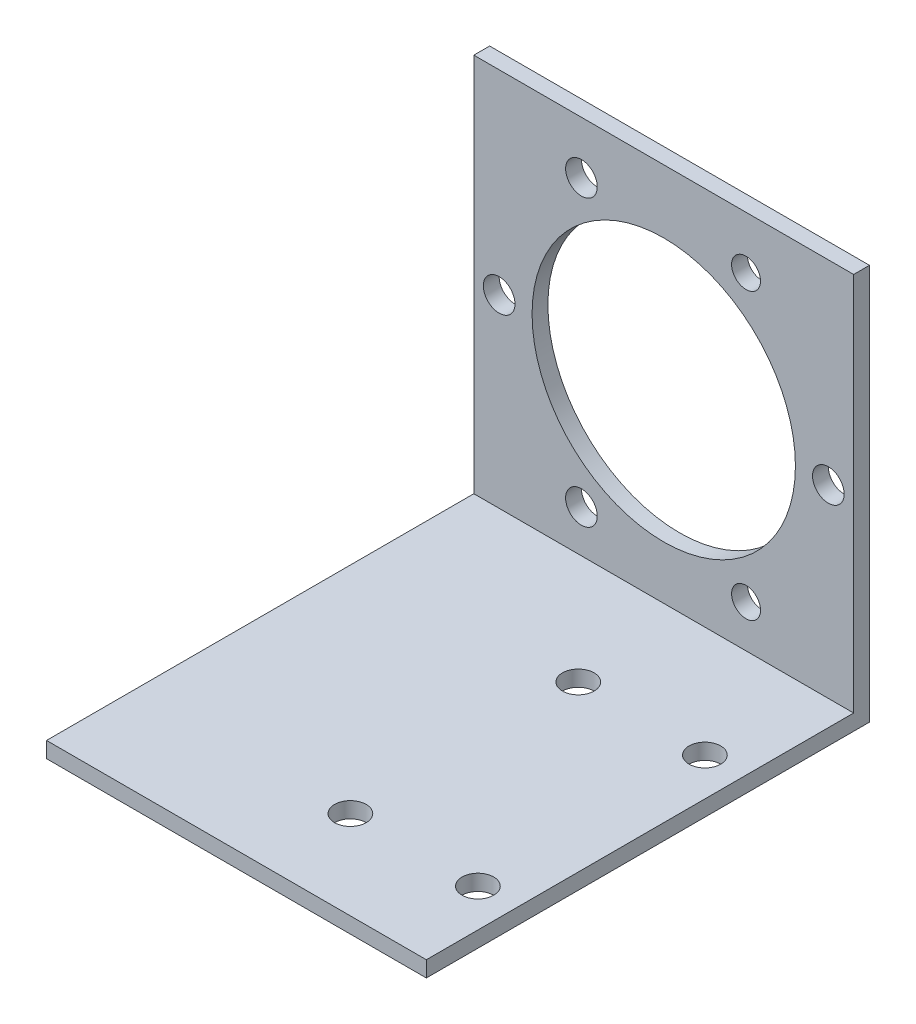
from build123d import *

# Parameters (mm, degrees)
SKETCH1_W                      = 38.1
SKETCH1_H                      = 1.5875
BOSS_EXTRUDE1_DEPTH            = 44.45
SKETCH2_W                      = 38.1
SKETCH2_H                      = 1.5875
BOSS_EXTRUDE2_DEPTH            = 38.1
SKETCH3_R                      = 13.208
CUT_EXTRUDE1_DEPTH             = 71.728425377
F_1_8_0_125_DIAMETER_HOLE3_D   = 3.175
F_1_8_0_125_DIAMETER_HOLE4_D   = 3.175
F_2_9_2_9_DIAMETER_HOLE1_D     = 2.9
F_2_9_2_9_DIAMETER_HOLE1_DEPTH = 3.556
F_2_9_2_9_DIAMETER_HOLE1_TIP   = 0.871247898


with BuildPart() as part:
    # Sketch1 → Boss-Extrude1 (new body)
    with BuildSketch(Plane.XY):
        with Locations((19.05, 0.79375)):
            Rectangle(SKETCH1_W, SKETCH1_H)
    extrude(amount=BOSS_EXTRUDE1_DEPTH)

    # Sketch2 → Boss-Extrude2 (add)
    with BuildSketch(Plane(origin=(0, 1.5875, 0), x_dir=(1, 0, 0), z_dir=(0, 1, 0))):
        with Locations((19.05, -0.79375)):
            Rectangle(SKETCH2_W, SKETCH2_H)
    extrude(amount=BOSS_EXTRUDE2_DEPTH)

    # Sketch3 → Cut-Extrude1 (cut, through all)
    with BuildSketch(Plane(origin=(0, 0, 0), x_dir=(-1, 0, 0), z_dir=(0, 0, -1))):
        with Locations((-19.05, 20.1295)):
            Circle(SKETCH3_R)
    extrude(amount=-CUT_EXTRUDE1_DEPTH, mode=Mode.SUBTRACT)

    # 1/8 (0.125) Diameter Hole3 (through all)
    with Locations(Plane(origin=(0, 0, 0), x_dir=(-1, 0, 0), z_dir=(0, 0, -1))):
        with Locations((-35.56, 20.1295), (-10.795, 34.427579416), (-2.54, 20.1295), (-10.795, 5.831420584)):
            Hole(F_1_8_0_125_DIAMETER_HOLE3_D / 2)

    # 1/8 (0.125) Diameter Hole4 (through all)
    with Locations(Plane(origin=(0, 1.5875, 0), x_dir=(1, 0, 0), z_dir=(0, 1, 0))):
        with Locations((34.29, -12.7), (21.59, -12.7), (21.59, -35.56), (34.29, -35.469930371)):
            Hole(F_1_8_0_125_DIAMETER_HOLE4_D / 2)

    # Ø2.9 (2.9) Diameter Hole1
    with Locations(Plane(origin=(0, 0, 0), x_dir=(-1, 0, 0), z_dir=(0, 0, -1))):
        with Locations((-27.305, 5.831420584), (-27.305, 34.427579416)):
            Hole(F_2_9_2_9_DIAMETER_HOLE1_D / 2, depth=F_2_9_2_9_DIAMETER_HOLE1_DEPTH)
            with Locations((0, 0, -(F_2_9_2_9_DIAMETER_HOLE1_DEPTH + F_2_9_2_9_DIAMETER_HOLE1_TIP / 2))):  # 118° drill point
                Cone(0, F_2_9_2_9_DIAMETER_HOLE1_D / 2, F_2_9_2_9_DIAMETER_HOLE1_TIP, mode=Mode.SUBTRACT)


solid = part.part
